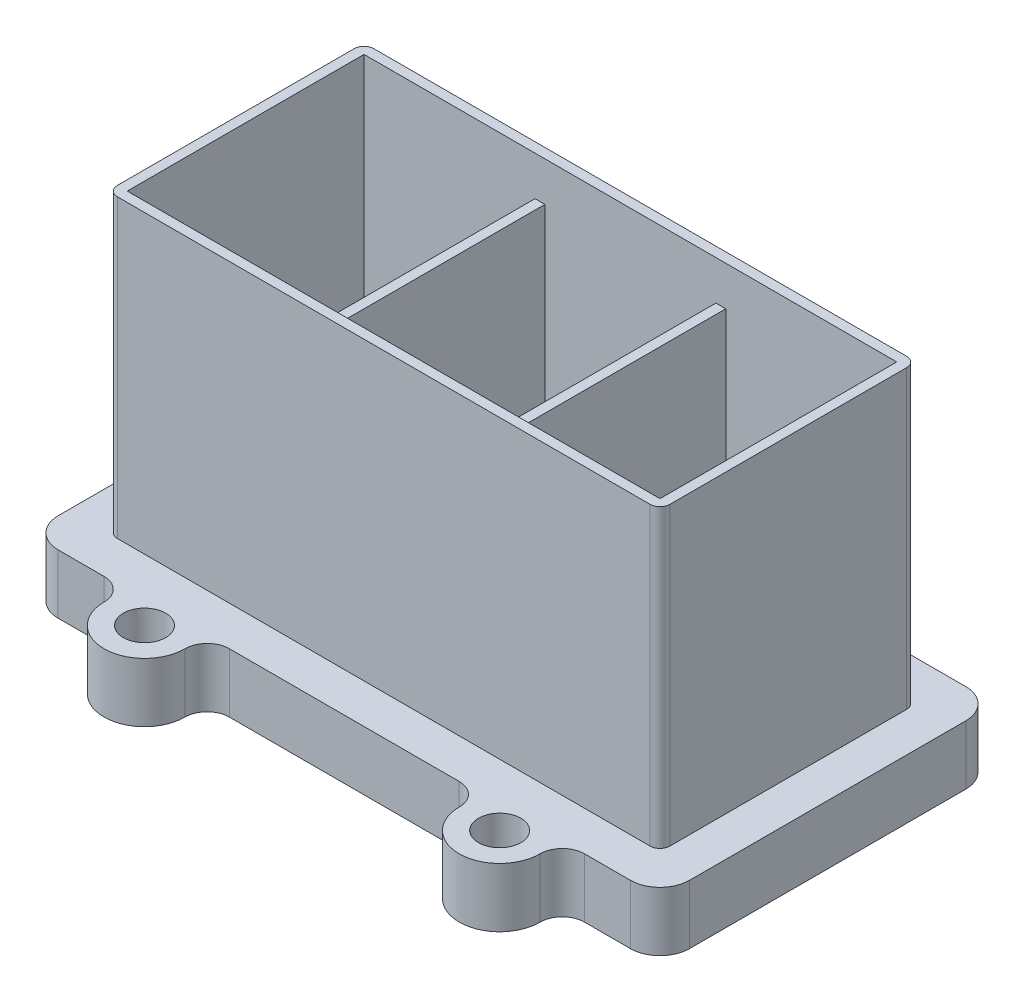
from build123d import *

# Parameters (mm, degrees)
BASE_PLATE_AND_PORTS_2_R   = 0.35
BASE_PLATE_AND_PORTS_2_R_2 = 1.075
BASE_PLATE_AND_PORTS_DEPTH = 1.5
BOSS_EXTRUDE1_DEPTH        = 15
RESERVOIRS_3_W             = 0.5
RESERVOIRS_3_H             = 12
BOSS_EXTRUDE2_DEPTH        = 13


with BuildPart() as part:
    # Base-plate and ports 2 → Base plate and ports (new, symmetric)
    with BuildSketch(Plane(origin=(0, 0, 0), x_dir=(1, 0, 0), z_dir=(0, 1, 0))):
        with BuildLine():
            Line((-16, -7), (-16, 7))
            ThreePointArc((-16, 7), (-15.560660172, 8.060660172), (-14.5, 8.5))
            Line((-14.5, 8.5), (-3.175, 8.5))
            ThreePointArc((-3.175, 8.5), (-2.379504871, 8.829504871), (-2.05, 9.625))
            ThreePointArc((-2.05, 9.625), (0, 11.675), (2.05, 9.625))
            ThreePointArc((2.05, 9.625), (2.379504871, 8.829504871), (3.175, 8.5))
            Line((3.175, 8.5), (14.5, 8.5))
            ThreePointArc((14.5, 8.5), (15.560660172, 8.060660172), (16, 7))
            Line((16, 7), (16, -7))
            ThreePointArc((16, -7), (15.560660172, -8.060660172), (14.5, -8.5))
            Line((14.5, -8.5), (12.175, -8.5))
            ThreePointArc((12.175, -8.5), (11.379504871, -8.829504871), (11.05, -9.625))
            ThreePointArc((11.05, -9.625), (9, -11.675), (6.95, -9.625))
            ThreePointArc((6.95, -9.625), (6.620495129, -8.829504871), (5.825, -8.5))
            Line((5.825, -8.5), (-5.825, -8.5))
            ThreePointArc((-5.825, -8.5), (-6.620495129, -8.829504871), (-6.95, -9.625))
            ThreePointArc((-6.95, -9.625), (-9, -11.675), (-11.05, -9.625))
            ThreePointArc((-11.05, -9.625), (-11.379504871, -8.829504871), (-12.175, -8.5))
            Line((-12.175, -8.5), (-14.5, -8.5))
            ThreePointArc((-14.5, -8.5), (-15.560660172, -8.060660172), (-16, -7))
        make_face()
        with Locations(Location((-10.5, 3, 0), (0, 0, 270))):
            Circle(BASE_PLATE_AND_PORTS_2_R, mode=Mode.SUBTRACT)
        with Locations(Location((0, 3, 0), (0, 0, 270))):
            Circle(BASE_PLATE_AND_PORTS_2_R, mode=Mode.SUBTRACT)
        with Locations(Location((10.5, 3, 0), (0, 0, 270))):
            Circle(BASE_PLATE_AND_PORTS_2_R, mode=Mode.SUBTRACT)
        with Locations(Location((0, -3, 0), (0, 0, 270))):
            Circle(BASE_PLATE_AND_PORTS_2_R, mode=Mode.SUBTRACT)
        with Locations(Location((10.5, -3, 0), (0, 0, 270))):
            Circle(BASE_PLATE_AND_PORTS_2_R, mode=Mode.SUBTRACT)
        with Locations(Location((-10.5, -3, 0), (0, 0, 270))):
            Circle(BASE_PLATE_AND_PORTS_2_R, mode=Mode.SUBTRACT)
        with Locations(Location((0, 9.625, 0), (0, 0, 270))):
            Circle(BASE_PLATE_AND_PORTS_2_R_2, mode=Mode.SUBTRACT)
        with Locations(Location((-9, -9.625, 0), (0, 0, 270))):
            Circle(BASE_PLATE_AND_PORTS_2_R_2, mode=Mode.SUBTRACT)
        with Locations(Location((9, -9.625, 0), (0, 0, 270))):
            Circle(BASE_PLATE_AND_PORTS_2_R_2, mode=Mode.SUBTRACT)
    extrude(amount=BASE_PLATE_AND_PORTS_DEPTH, both=True)

    # Reservoirs → Boss-Extrude1 (add)
    with BuildSketch(Plane(origin=(0, 1.5, 0), x_dir=(1, 0, 0), z_dir=(0, 1, 0))):
        with BuildLine():
            Line((-13.5, 6.5), (13.5, 6.5))
            ThreePointArc((13.5, 6.5), (13.853553391, 6.353553391), (14, 6))
            Line((14, 6), (14, -6))
            ThreePointArc((14, -6), (13.853553391, -6.353553391), (13.5, -6.5))
            Line((13.5, -6.5), (-13.5, -6.5))
            ThreePointArc((-13.5, -6.5), (-13.853553391, -6.353553391), (-14, -6))
            Line((-14, -6), (-14, 6))
            ThreePointArc((-14, 6), (-13.853553391, 6.353553391), (-13.5, 6.5))
        make_face()
        Polygon((-4.333333333, -6), (4.333333333, -6), (4.833333333, -6), (13.5, -6), (13.5, 6), (4.833333333, 6), (4.333333333, 6), (-4.333333333, 6), (-4.833333333, 6), (-13.5, 6), (-13.5, -6), (-4.833333333, -6), align=None, mode=Mode.SUBTRACT)
    extrude(amount=BOSS_EXTRUDE1_DEPTH)

    # Reservoirs<3> → Boss-Extrude2 (add)
    with BuildSketch(Plane(origin=(0, 1.5, 0), x_dir=(1, 0, 0), z_dir=(0, 1, 0))):
        with Locations((-4.583333333, 0)):
            Rectangle(RESERVOIRS_3_W, RESERVOIRS_3_H)
        with Locations((4.583333333, 0)):
            Rectangle(RESERVOIRS_3_W, RESERVOIRS_3_H)
    extrude(amount=BOSS_EXTRUDE2_DEPTH)


solid = part.part
